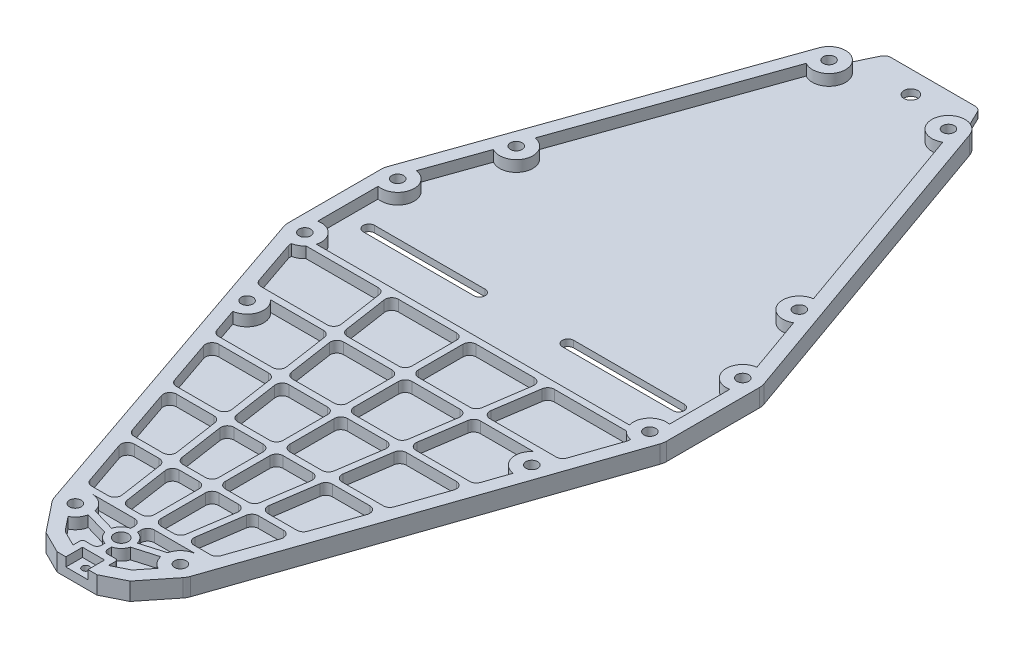
from build123d import *

# Parameters (mm, degrees)
SKETCH1_R           = 2.65
SKETCH1_R_2         = 3.15
SKETCH1_R_3         = 1.65
BOSS_EXTRUDE2_DEPTH = 8
CUT_EXTRUDE1_START  = -5
CUT_EXTRUDE1_DEPTH  = 5
SKETCH3_W           = 10
SKETCH3_H           = 7.5
CUT_EXTRUDE2_DEPTH  = 4


with BuildPart() as part:
    # Sketch1 → Boss-Extrude2 (new body)
    with BuildSketch(Plane(origin=(0, 0, 0), x_dir=(1, 0, 0), z_dir=(0, 1, 0))):
        with BuildLine():
            ThreePointArc((29.642776271, -183.639524525), (30.335989066, -182.588139912), (30.843511675, -181.43558866))
            Line((30.843511675, -181.43558866), (85.093511699, -23.435588591))
            ThreePointArc((85.093511699, -23.435588591), (85.397679965, -22.234638056), (85.5, -21))
            Line((85.5, -21), (85.5, 21))
            ThreePointArc((85.5, 21), (85.391643298, 22.270279243), (85.069704172, 23.503853614))
            Line((85.069704172, 23.503853614), (34.069704189, 167.503853567))
            ThreePointArc((34.069704189, 167.503853567), (31.328458054, 171.124904152), (27, 172.5))
            Line((27, 172.5), (21.816867263, 183.298193203))
            ThreePointArc((21.816867263, 183.298193203), (20.710018402, 184.539151394), (19.11229809, 185))
            Line((19.11229809, 185), (-19.11229809, 185))
            ThreePointArc((-19.11229809, 185), (-20.710018402, 184.539151394), (-21.816867263, 183.298193203))
            Line((-21.816867263, 183.298193203), (-27, 172.5))
            ThreePointArc((-27, 172.5), (-31.328458054, 171.124904152), (-34.069704189, 167.503853567))
            Line((-34.069704189, 167.503853567), (-85.069704106, 23.503853801))
            ThreePointArc((-85.069704106, 23.503853801), (-85.391643281, 22.270279341), (-85.5, 21))
            Line((-85.5, 21), (-85.5, -21))
            ThreePointArc((-85.5, -21), (-85.397679959, -22.234638094), (-85.093511674, -23.435588663))
            Line((-85.093511674, -23.435588663), (-30.843511675, -181.43558866))
            ThreePointArc((-30.843511675, -181.43558866), (-30.335989066, -182.588139912), (-29.642776271, -183.639524525))
            Line((-29.642776271, -183.639524525), (-19, -197))
            Line((-19, -197), (-9, -202))
            Line((-9, -202), (9, -202))
            Line((9, -202), (19, -197))
            Line((19, -197), (29.642776271, -183.639524525))
        make_face()
        with Locations(Location((23.75, -179, 0), (0, 0, 270))):
            Circle(SKETCH1_R, mode=Mode.SUBTRACT)
        with Locations(Location((0, 175, 0), (0, 0, 270))):
            Circle(SKETCH1_R_2, mode=Mode.SUBTRACT)
        with Locations(Location((-23.75, -179, 0), (0, 0, 270))):
            Circle(SKETCH1_R, mode=Mode.SUBTRACT)
        with Locations(Location((0, -198, 0), (0, 0, 270))):
            Circle(SKETCH1_R_3, mode=Mode.SUBTRACT)
        with Locations(Location((0, -182, 0), (0, 0, 270))):
            Circle(SKETCH1_R_2, mode=Mode.SUBTRACT)
        with BuildLine():
            ThreePointArc((-20, 2.55), (-17.45, 0), (-20, -2.55))
            Line((-20, -2.55), (-70, -2.55))
            ThreePointArc((-70, -2.55), (-72.55, 0), (-70, 2.55))
            Line((-70, 2.55), (-20, 2.55))
        make_face(mode=Mode.SUBTRACT)
        with BuildLine():
            Line((70, -2.55), (20, -2.55))
            ThreePointArc((20, -2.55), (17.45, 0), (20, 2.55))
            Line((20, 2.55), (70, 2.55))
            ThreePointArc((70, 2.55), (72.55, 0), (70, -2.55))
        make_face(mode=Mode.SUBTRACT)
        with Locations(Location((63.978420026, 60.590343457, 0), (0, 0, 270))):
            Circle(SKETCH1_R, mode=Mode.SUBTRACT)
        with Locations(Location((-64.360703502, -60.723665378, 0), (0, 0, 270))):
            Circle(SKETCH1_R, mode=Mode.SUBTRACT)
        with Locations(Location((64.360703502, -60.723665378, 0), (0, 0, 270))):
            Circle(SKETCH1_R, mode=Mode.SUBTRACT)
        with Locations(Location((-63.978420026, 60.590343457, 0), (0, 0, 270))):
            Circle(SKETCH1_R, mode=Mode.SUBTRACT)
        with Locations(Location((78, -21, 0), (0, 0, 270))):
            Circle(SKETCH1_R, mode=Mode.SUBTRACT)
        with Locations(Location((-78, -21, 0), (0, 0, 270))):
            Circle(SKETCH1_R, mode=Mode.SUBTRACT)
        with Locations(Location((78, 21, 0), (0, 0, 270))):
            Circle(SKETCH1_R, mode=Mode.SUBTRACT)
        with Locations(Location((-78, 21, 0), (0, 0, 270))):
            Circle(SKETCH1_R, mode=Mode.SUBTRACT)
        with Locations(Location((27, 165, 0), (0, 0, 270))):
            Circle(SKETCH1_R, mode=Mode.SUBTRACT)
        with Locations(Location((-27, 165, 0), (0, 0, 270))):
            Circle(SKETCH1_R, mode=Mode.SUBTRACT)
    extrude(amount=BOSS_EXTRUDE2_DEPTH)

    # Sketch2 → Cut-Extrude1 (cut)
    with BuildSketch(Plane(origin=(0, 8, 0), x_dir=(1, 0, 0), z_dir=(0, 1, 0)).offset(CUT_EXTRUDE1_START)):
        with BuildLine():
            ThreePointArc((-27, 172.5), (-19.773461294, 162.993226886), (-30.867206289, 158.573903555))
            Line((-30.867206289, 158.573903555), (-62.939095412, 68.017981328))
            ThreePointArc((-62.939095412, 68.017981328), (-56.908715837, 58.08648989), (-67.845626315, 54.164247012))
            Line((-67.845626315, 54.164247012), (-76.960675386, 28.427637871))
            ThreePointArc((-76.960675386, 28.427637871), (-70.608356698, 19.729720782), (-79.5, 13.651530772))
            Line((-79.5, 13.651530772), (-79.5, -13.651530772))
            ThreePointArc((-79.5, -13.651530772), (-72.518015221, -15.881617161), (-70.771583853, -23))
            Line((-70.771583853, -23), (70.771583853, -23))
            ThreePointArc((70.771583853, -23), (72.518015221, -15.881617161), (79.5, -13.651530772))
            Line((79.5, -13.651530772), (79.5, 13.651530772))
            ThreePointArc((79.5, 13.651530772), (70.608356698, 19.729720782), (76.960675386, 28.427637871))
            Line((76.960675386, 28.427637871), (67.845626315, 54.164247012))
            ThreePointArc((67.845626315, 54.164247012), (56.908715837, 58.08648989), (62.939095412, 68.017981328))
            Line((62.939095412, 68.017981328), (30.867206289, 158.573903555))
            ThreePointArc((30.867206289, 158.573903555), (19.773461294, 162.993226886), (27, 172.5))
            Line((27, 172.5), (21, 185))
            Line((21, 185), (-21, 185))
            Line((-21, 185), (-27, 172.5))
        make_face()
        with BuildLine():
            Line((29.636733114, -166.474235464), (36.538157164, -146.374235464))
            ThreePointArc((36.538157164, -146.374235464), (36.142340747, -143.656828521), (33.700752494, -142.4))
            Line((33.700752494, -142.4), (22.459832001, -142.4))
            ThreePointArc((22.459832001, -142.4), (20.500942249, -143.127831226), (19.492546583, -144.958166042))
            Line((19.492546583, -144.958166042), (16.499621635, -165.058166042))
            ThreePointArc((16.499621635, -165.058166042), (17.194738279, -167.458889753), (19.466907053, -168.5))
            Line((19.466907053, -168.5), (26.799328444, -168.5))
            ThreePointArc((26.799328444, -168.5), (28.542499922, -167.941588253), (29.636733114, -166.474235464))
        make_face()
        with BuildLine():
            Line((39.628347038, -137.374235464), (46.529771088, -117.274235464))
            ThreePointArc((46.529771088, -117.274235464), (46.133954671, -114.556828521), (43.692366418, -113.3))
            Line((43.692366418, -113.3), (26.792872598, -113.3))
            ThreePointArc((26.792872598, -113.3), (24.833982845, -114.027831226), (23.82558718, -115.858166042))
            Line((23.82558718, -115.858166042), (20.832662232, -135.958166042))
            ThreePointArc((20.832662232, -135.958166042), (21.527778876, -138.358889753), (23.79994765, -139.4))
            Line((23.79994765, -139.4), (36.790942368, -139.4))
            ThreePointArc((36.790942368, -139.4), (38.534113846, -138.841588253), (39.628347038, -137.374235464))
        make_face()
        with BuildLine():
            Line((49.619960962, -108.274235464), (56.521385012, -88.174235464))
            ThreePointArc((56.521385012, -88.174235464), (56.125568595, -85.456828521), (53.683980343, -84.2))
            Line((53.683980343, -84.2), (31.125913195, -84.2))
            ThreePointArc((31.125913195, -84.2), (29.167023442, -84.927831226), (28.158627777, -86.758166042))
            Line((28.158627777, -86.758166042), (25.165702828, -106.858166042))
            ThreePointArc((25.165702828, -106.858166042), (25.860819473, -109.258889753), (28.132988247, -110.3))
            Line((28.132988247, -110.3), (46.782556292, -110.3))
            ThreePointArc((46.782556292, -110.3), (48.52572777, -109.741588253), (49.619960962, -108.274235464))
        make_face()
        with BuildLine():
            ThreePointArc((-33.700752494, -142.4), (-36.142340747, -143.656828521), (-36.538157164, -146.374235464))
            Line((-36.538157164, -146.374235464), (-29.636733114, -166.474235464))
            ThreePointArc((-29.636733114, -166.474235464), (-28.542499922, -167.941588253), (-26.799328444, -168.5))
            Line((-26.799328444, -168.5), (-19.466907053, -168.5))
            ThreePointArc((-19.466907053, -168.5), (-17.194738279, -167.458889753), (-16.499621635, -165.058166042))
            Line((-16.499621635, -165.058166042), (-19.492546583, -144.958166042))
            ThreePointArc((-19.492546583, -144.958166042), (-20.500942249, -143.127831226), (-22.459832001, -142.4))
            Line((-22.459832001, -142.4), (-33.700752494, -142.4))
        make_face()
        with BuildLine():
            ThreePointArc((-43.692366418, -113.3), (-46.133954671, -114.556828521), (-46.529771088, -117.274235464))
            Line((-46.529771088, -117.274235464), (-39.628347038, -137.374235464))
            ThreePointArc((-39.628347038, -137.374235464), (-38.534113846, -138.841588253), (-36.790942368, -139.4))
            Line((-36.790942368, -139.4), (-23.79994765, -139.4))
            ThreePointArc((-23.79994765, -139.4), (-21.527778876, -138.358889753), (-20.832662232, -135.958166042))
            Line((-20.832662232, -135.958166042), (-23.82558718, -115.858166042))
            ThreePointArc((-23.82558718, -115.858166042), (-24.833982845, -114.027831226), (-26.792872598, -113.3))
            Line((-26.792872598, -113.3), (-43.692366418, -113.3))
        make_face()
        with BuildLine():
            ThreePointArc((-53.683980343, -84.2), (-56.125568595, -85.456828521), (-56.521385012, -88.174235464))
            Line((-56.521385012, -88.174235464), (-49.619960962, -108.274235464))
            ThreePointArc((-49.619960962, -108.274235464), (-48.52572777, -109.741588253), (-46.782556292, -110.3))
            Line((-46.782556292, -110.3), (-28.132988247, -110.3))
            ThreePointArc((-28.132988247, -110.3), (-25.860819473, -109.258889753), (-25.165702828, -106.858166042))
            Line((-25.165702828, -106.858166042), (-28.158627777, -86.758166042))
            ThreePointArc((-28.158627777, -86.758166042), (-29.167023442, -84.927831226), (-31.125913195, -84.2))
            Line((-31.125913195, -84.2), (-53.683980343, -84.2))
        make_face()
        with BuildLine():
            Line((-39.791994388, -26), (-72.409830056, -26))
            ThreePointArc((-72.409830056, -26), (-74.309748564, -27.529321889), (-76.599916295, -28.368158903))
            ThreePointArc((-76.599916295, -28.368158903), (-76.661940372, -29.177705267), (-76.50461286, -29.974235464))
            Line((-76.50461286, -29.974235464), (-69.60318881, -50.074235464))
            ThreePointArc((-69.60318881, -50.074235464), (-68.508955619, -51.541588253), (-66.76578414, -52.1))
            Line((-66.76578414, -52.1), (-36.79906944, -52.1))
            ThreePointArc((-36.79906944, -52.1), (-34.526900666, -51.058889753), (-33.831784022, -48.658166042))
            Line((-33.831784022, -48.658166042), (-36.82470897, -28.558166042))
            ThreePointArc((-36.82470897, -28.558166042), (-37.833104636, -26.727831226), (-39.791994388, -26))
        make_face()
        with BuildLine():
            ThreePointArc((76.599916295, -28.368158903), (74.309748564, -27.529321889), (72.409830056, -26))
            Line((72.409830056, -26), (39.791994388, -26))
            ThreePointArc((39.791994388, -26), (37.833104636, -26.727831226), (36.82470897, -28.558166042))
            Line((36.82470897, -28.558166042), (33.831784022, -48.658166042))
            ThreePointArc((33.831784022, -48.658166042), (34.526900666, -51.058889753), (36.79906944, -52.1))
            Line((36.79906944, -52.1), (66.76578414, -52.1))
            ThreePointArc((66.76578414, -52.1), (68.508955619, -51.541588253), (69.60318881, -50.074235464))
            Line((69.60318881, -50.074235464), (76.50461286, -29.974235464))
            ThreePointArc((76.50461286, -29.974235464), (76.661940372, -29.177705267), (76.599916295, -28.368158903))
        make_face()
        with BuildLine():
            Line((-35.458953792, -55.1), (-59.398406884, -55.1))
            ThreePointArc((-59.398406884, -55.1), (-57.188644769, -62.917195303), (-63.39302606, -68.160976745))
            Line((-63.39302606, -68.160976745), (-59.611574886, -79.174235464))
            ThreePointArc((-59.611574886, -79.174235464), (-58.517341695, -80.641588253), (-56.774170216, -81.2))
            Line((-56.774170216, -81.2), (-32.466028843, -81.2))
            ThreePointArc((-32.466028843, -81.2), (-30.193860069, -80.158889753), (-29.498743425, -77.758166042))
            Line((-29.498743425, -77.758166042), (-32.491668373, -57.658166042))
            ThreePointArc((-32.491668373, -57.658166042), (-33.500064039, -55.827831226), (-35.458953792, -55.1))
        make_face()
        with BuildLine():
            ThreePointArc((63.39302606, -68.160976745), (57.188644769, -62.917195303), (59.398406884, -55.1))
            Line((59.398406884, -55.1), (35.458953792, -55.1))
            ThreePointArc((35.458953792, -55.1), (33.500064039, -55.827831226), (32.491668373, -57.658166042))
            Line((32.491668373, -57.658166042), (29.498743425, -77.758166042))
            ThreePointArc((29.498743425, -77.758166042), (30.193860069, -80.158889753), (32.466028843, -81.2))
            Line((32.466028843, -81.2), (56.774170216, -81.2))
            ThreePointArc((56.774170216, -81.2), (58.517341695, -80.641588253), (59.611574886, -79.174235464))
            Line((59.611574886, -79.174235464), (63.39302606, -68.160976745))
        make_face()
        with BuildLine():
            ThreePointArc((-16.405129565, -180.517523739), (-17.786697646, -183.548518994), (-20.344564231, -185.682290567))
            Line((-20.344564231, -185.682290567), (-15.544745647, -191.70777272))
            ThreePointArc((-15.544745647, -191.70777272), (-15.086700757, -192.169606488), (-14.539878034, -192.521857051))
            Line((-14.539878034, -192.521857051), (-8.217028989, -195.683281573))
            ThreePointArc((-8.217028989, -195.683281573), (-8.109486657, -195.734410541), (-8, -195.781231437))
            Line((-8, -195.781231437), (-8, -192.5))
            ThreePointArc((-8, -192.5), (-7.707106781, -191.792893219), (-7, -191.5))
            Line((-7, -191.5), (-3.5, -191.5))
            ThreePointArc((-3.5, -191.5), (-2.085786438, -190.914213562), (-1.5, -189.5))
            Line((-1.5, -189.5), (-1.5, -187.809475019))
            ThreePointArc((-1.5, -187.809475019), (-4.195179575, -186.289576708), (-5.774664681, -183.628879315))
            Line((-5.774664681, -183.628879315), (-16.405129565, -180.517523739))
        make_face()
        with BuildLine():
            Line((-4.5, -171.5), (-23.75, -171.5))
            ThreePointArc((-23.75, -171.5), (-19.052015324, -173.153724263), (-16.425809648, -177.385616003))
            Line((-16.425809648, -177.385616003), (-5.807751434, -180.493340358))
            ThreePointArc((-5.807751434, -180.493340358), (-4.240207872, -177.754927892), (-1.5, -176.190524981))
            Line((-1.5, -176.190524981), (-1.5, -174.5))
            ThreePointArc((-1.5, -174.5), (-2.378679656, -172.378679656), (-4.5, -171.5))
        make_face()
        with BuildLine():
            ThreePointArc((5.774664681, -183.628879315), (4.195179575, -186.289576708), (1.5, -187.809475019))
            Line((1.5, -187.809475019), (1.5, -189.5))
            ThreePointArc((1.5, -189.5), (2.085786438, -190.914213562), (3.5, -191.5))
            Line((3.5, -191.5), (7, -191.5))
            ThreePointArc((7, -191.5), (7.707106781, -191.792893219), (8, -192.5))
            Line((8, -192.5), (8, -195.781231437))
            ThreePointArc((8, -195.781231437), (8.109486657, -195.734410541), (8.217028989, -195.683281573))
            Line((8.217028989, -195.683281573), (14.539878034, -192.521857051))
            ThreePointArc((14.539878034, -192.521857051), (15.086700757, -192.169606488), (15.544745647, -191.70777272))
            Line((15.544745647, -191.70777272), (20.344564231, -185.682290567))
            ThreePointArc((20.344564231, -185.682290567), (17.786697646, -183.548518994), (16.405129565, -180.517523739))
            Line((16.405129565, -180.517523739), (5.774664681, -183.628879315))
        make_face()
        with BuildLine():
            Line((1.5, -174.5), (1.5, -176.190524981))
            ThreePointArc((1.5, -176.190524981), (4.240207872, -177.754927892), (5.807751434, -180.493340358))
            Line((5.807751434, -180.493340358), (16.425809648, -177.385616003))
            ThreePointArc((16.425809648, -177.385616003), (19.052015324, -173.153724263), (23.75, -171.5))
            Line((23.75, -171.5), (4.5, -171.5))
            ThreePointArc((4.5, -171.5), (2.378679656, -172.378679656), (1.5, -174.5))
        make_face()
        with BuildLine():
            Line((-1.5, -49.1), (-1.5, -29))
            ThreePointArc((-1.5, -29), (-2.378679656, -26.878679656), (-4.5, -26))
            Line((-4.5, -26), (-30.6927686, -26))
            ThreePointArc((-30.6927686, -26), (-32.964937374, -27.041110247), (-33.660054018, -29.441833958))
            Line((-33.660054018, -29.441833958), (-30.66712907, -49.541833958))
            ThreePointArc((-30.66712907, -49.541833958), (-29.658733404, -51.372168774), (-27.699843651, -52.1))
            Line((-27.699843651, -52.1), (-4.5, -52.1))
            ThreePointArc((-4.5, -52.1), (-2.378679656, -51.221320344), (-1.5, -49.1))
        make_face()
        with BuildLine():
            Line((-1.5, -78.2), (-1.5, -58.1))
            ThreePointArc((-1.5, -58.1), (-2.378679656, -55.978679656), (-4.5, -55.1))
            Line((-4.5, -55.1), (-26.359728003, -55.1))
            ThreePointArc((-26.359728003, -55.1), (-28.631896777, -56.141110247), (-29.327013421, -58.541833958))
            Line((-29.327013421, -58.541833958), (-26.334088473, -78.641833958))
            ThreePointArc((-26.334088473, -78.641833958), (-25.325692807, -80.472168774), (-23.366803055, -81.2))
            Line((-23.366803055, -81.2), (-4.5, -81.2))
            ThreePointArc((-4.5, -81.2), (-2.378679656, -80.321320344), (-1.5, -78.2))
        make_face()
        with BuildLine():
            Line((-1.5, -107.3), (-1.5, -87.2))
            ThreePointArc((-1.5, -87.2), (-2.378679656, -85.078679656), (-4.5, -84.2))
            Line((-4.5, -84.2), (-22.026687406, -84.2))
            ThreePointArc((-22.026687406, -84.2), (-24.29885618, -85.241110247), (-24.993972825, -87.641833958))
            Line((-24.993972825, -87.641833958), (-22.001047876, -107.741833958))
            ThreePointArc((-22.001047876, -107.741833958), (-20.992652211, -109.572168774), (-19.033762458, -110.3))
            Line((-19.033762458, -110.3), (-4.5, -110.3))
            ThreePointArc((-4.5, -110.3), (-2.378679656, -109.421320344), (-1.5, -107.3))
        make_face()
        with BuildLine():
            Line((-1.5, -165.5), (-1.5, -145.4))
            ThreePointArc((-1.5, -145.4), (-2.378679656, -143.278679656), (-4.5, -142.4))
            Line((-4.5, -142.4), (-13.360606213, -142.4))
            ThreePointArc((-13.360606213, -142.4), (-15.632774987, -143.441110247), (-16.327891631, -145.841833958))
            Line((-16.327891631, -145.841833958), (-13.334966683, -165.941833958))
            ThreePointArc((-13.334966683, -165.941833958), (-12.326571017, -167.772168774), (-10.367681265, -168.5))
            Line((-10.367681265, -168.5), (-4.5, -168.5))
            ThreePointArc((-4.5, -168.5), (-2.378679656, -167.621320344), (-1.5, -165.5))
        make_face()
        with BuildLine():
            Line((-1.5, -136.4), (-1.5, -116.3))
            ThreePointArc((-1.5, -116.3), (-2.378679656, -114.178679656), (-4.5, -113.3))
            Line((-4.5, -113.3), (-17.69364681, -113.3))
            ThreePointArc((-17.69364681, -113.3), (-19.965815583, -114.341110247), (-20.660932228, -116.741833958))
            Line((-20.660932228, -116.741833958), (-17.66800728, -136.841833958))
            ThreePointArc((-17.66800728, -136.841833958), (-16.659611614, -138.672168774), (-14.700721861, -139.4))
            Line((-14.700721861, -139.4), (-4.5, -139.4))
            ThreePointArc((-4.5, -139.4), (-2.378679656, -138.521320344), (-1.5, -136.4))
        make_face()
        with BuildLine():
            ThreePointArc((20.660932228, -116.741833958), (19.965815583, -114.341110247), (17.69364681, -113.3))
            Line((17.69364681, -113.3), (4.5, -113.3))
            ThreePointArc((4.5, -113.3), (2.378679656, -114.178679656), (1.5, -116.3))
            Line((1.5, -116.3), (1.5, -136.4))
            ThreePointArc((1.5, -136.4), (2.378679656, -138.521320344), (4.5, -139.4))
            Line((4.5, -139.4), (14.700721861, -139.4))
            ThreePointArc((14.700721861, -139.4), (16.659611614, -138.672168774), (17.66800728, -136.841833958))
            Line((17.66800728, -136.841833958), (20.660932228, -116.741833958))
        make_face()
        with BuildLine():
            ThreePointArc((16.327891631, -145.841833958), (15.632774987, -143.441110247), (13.360606213, -142.4))
            Line((13.360606213, -142.4), (4.5, -142.4))
            ThreePointArc((4.5, -142.4), (2.378679656, -143.278679656), (1.5, -145.4))
            Line((1.5, -145.4), (1.5, -165.5))
            ThreePointArc((1.5, -165.5), (2.378679656, -167.621320344), (4.5, -168.5))
            Line((4.5, -168.5), (10.367681265, -168.5))
            ThreePointArc((10.367681265, -168.5), (12.326571017, -167.772168774), (13.334966683, -165.941833958))
            Line((13.334966683, -165.941833958), (16.327891631, -145.841833958))
        make_face()
        with BuildLine():
            ThreePointArc((24.993972825, -87.641833958), (24.29885618, -85.241110247), (22.026687406, -84.2))
            Line((22.026687406, -84.2), (4.5, -84.2))
            ThreePointArc((4.5, -84.2), (2.378679656, -85.078679656), (1.5, -87.2))
            Line((1.5, -87.2), (1.5, -107.3))
            ThreePointArc((1.5, -107.3), (2.378679656, -109.421320344), (4.5, -110.3))
            Line((4.5, -110.3), (19.033762458, -110.3))
            ThreePointArc((19.033762458, -110.3), (20.992652211, -109.572168774), (22.001047876, -107.741833958))
            Line((22.001047876, -107.741833958), (24.993972825, -87.641833958))
        make_face()
        with BuildLine():
            ThreePointArc((29.327013421, -58.541833958), (28.631896777, -56.141110247), (26.359728003, -55.1))
            Line((26.359728003, -55.1), (4.5, -55.1))
            ThreePointArc((4.5, -55.1), (2.378679656, -55.978679656), (1.5, -58.1))
            Line((1.5, -58.1), (1.5, -78.2))
            ThreePointArc((1.5, -78.2), (2.378679656, -80.321320344), (4.5, -81.2))
            Line((4.5, -81.2), (23.366803055, -81.2))
            ThreePointArc((23.366803055, -81.2), (25.325692807, -80.472168774), (26.334088473, -78.641833958))
            Line((26.334088473, -78.641833958), (29.327013421, -58.541833958))
        make_face()
        with BuildLine():
            ThreePointArc((33.660054018, -29.441833958), (32.964937374, -27.041110247), (30.6927686, -26))
            Line((30.6927686, -26), (4.5, -26))
            ThreePointArc((4.5, -26), (2.378679656, -26.878679656), (1.5, -29))
            Line((1.5, -29), (1.5, -49.1))
            ThreePointArc((1.5, -49.1), (2.378679656, -51.221320344), (4.5, -52.1))
            Line((4.5, -52.1), (27.699843651, -52.1))
            ThreePointArc((27.699843651, -52.1), (29.658733404, -51.372168774), (30.66712907, -49.541833958))
            Line((30.66712907, -49.541833958), (33.660054018, -29.441833958))
        make_face()
    extrude(amount=CUT_EXTRUDE1_DEPTH, mode=Mode.SUBTRACT)

    # Sketch3 → Cut-Extrude2 (cut)
    with BuildSketch(Plane(origin=(0, 8, 0), x_dir=(1, 0, 0), z_dir=(0, 1, 0))):
        with Locations((0, -198.25)):
            Rectangle(SKETCH3_W, SKETCH3_H)
    extrude(amount=-CUT_EXTRUDE2_DEPTH, mode=Mode.SUBTRACT)


solid = part.part
